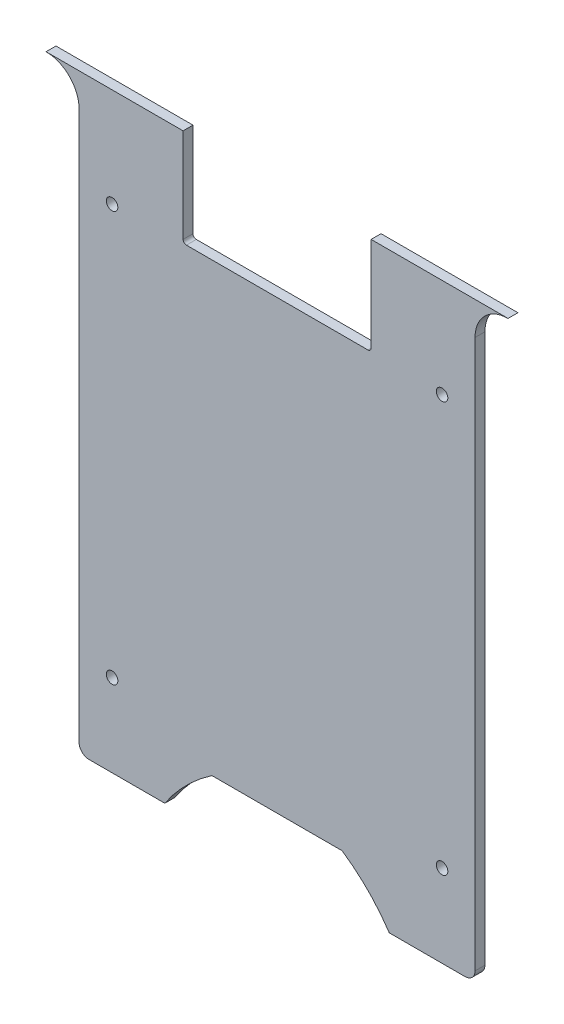
from build123d import *

# Parameters (mm, degrees)
SKETCH1_R           = 1.75
BOSS_EXTRUDE1_DEPTH = 3


with BuildPart() as part:
    # Sketch1 → Boss-Extrude1 (new body)
    with BuildSketch(Plane.XY):
        with BuildLine():
            Line((-69.999999999, 218.999999943), (-28.469288178, 218.999999943))
            Line((-28.469288178, 218.999999943), (-28.469288178, 190.499999944))
            ThreePointArc((-28.469288178, 190.499999944), (-28.176394959, 189.792893162), (-27.469288178, 189.499999944))
            Line((-27.469288178, 189.499999944), (27.510237275, 189.499999944))
            ThreePointArc((27.510237275, 189.499999944), (28.217344056, 189.792893162), (28.510237275, 190.499999944))
            Line((28.510237275, 190.499999944), (28.510237275, 219.000000001))
            Line((28.510237275, 219.000000001), (70, 219.000000001))
            ThreePointArc((70, 219.000000001), (62.928932188, 216.071067813), (60, 209.000000001))
            Line((60, 209.000000001), (60.000000001, 42.74629253))
            ThreePointArc((60.000000001, 42.74629253), (59.121320345, 40.624972187), (57.000000001, 39.74629253))
            Line((57.000000001, 39.74629253), (34.010726172, 39.74629253))
            add(Edge.make_bspline(
                [(19.726580347, 54.15000005), (28.313482135, 48.285383123), (34.010726172, 39.74629253)],
                knots=[0, 0, 0, 1, 1, 1], degree=2))
            Line((19.726580347, 54.15000005), (-19.726580417, 54.150000001))
            add(Edge.make_bspline(
                [(-34.010726207, 39.746292473), (-28.313482185, 48.285383067), (-19.726580417, 54.150000001)],
                knots=[0, 0, 0, 1, 1, 1], degree=2))
            Line((-34.010726207, 39.746292473), (-56.999999999, 39.746292473))
            ThreePointArc((-56.999999999, 39.746292473), (-59.121320343, 40.624972129), (-59.999999999, 42.746292473))
            Line((-59.999999999, 42.746292473), (-59.999999999, 208.999999944))
            ThreePointArc((-59.999999999, 208.999999944), (-62.928932187, 216.071067755), (-69.999999999, 218.999999943))
        make_face()
        with Locations((-50, 189)):
            Circle(SKETCH1_R, mode=Mode.SUBTRACT)
        with Locations((50, 189.000000001)):
            Circle(SKETCH1_R, mode=Mode.SUBTRACT)
        with Locations((-49.999999999, 64.74629253)):
            Circle(SKETCH1_R, mode=Mode.SUBTRACT)
        with Locations((50.000000001, 64.74629253)):
            Circle(SKETCH1_R, mode=Mode.SUBTRACT)
    extrude(amount=BOSS_EXTRUDE1_DEPTH)


solid = part.part
